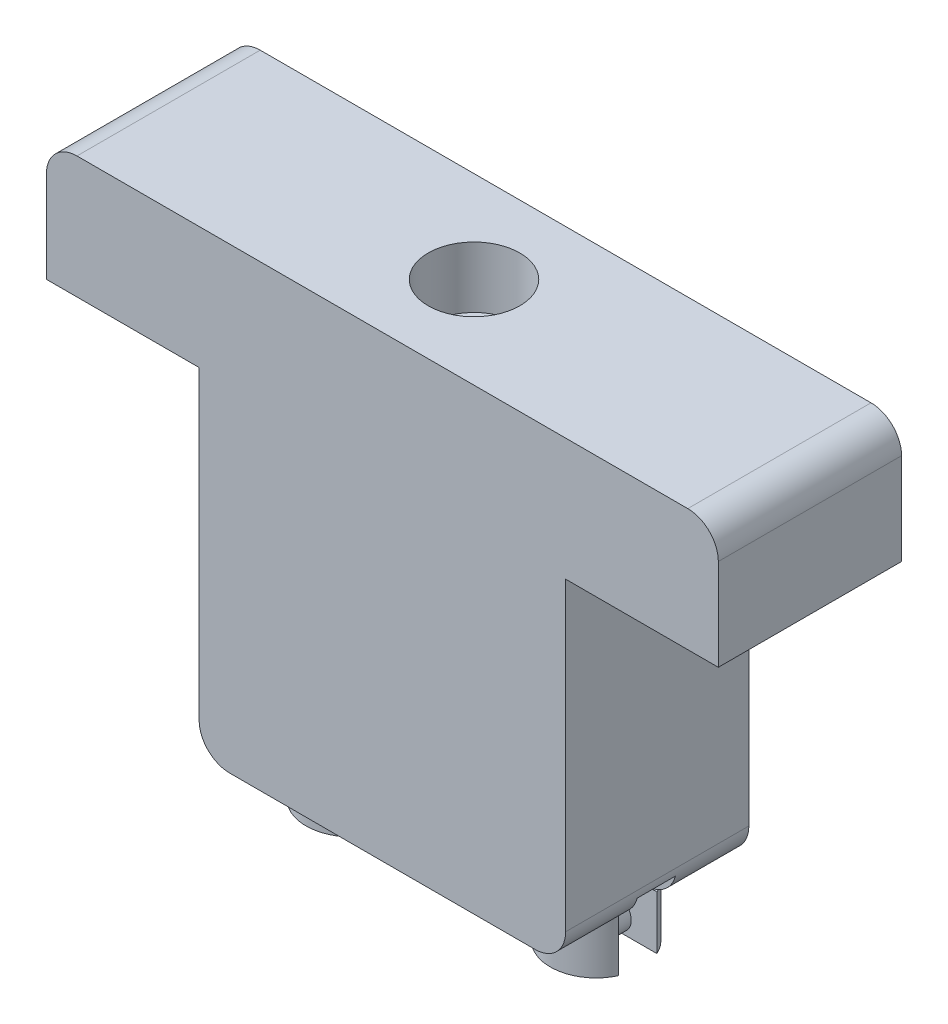
from build123d import *

# Parameters (mm, degrees)
SKETCH1_W           = 304.8
SKETCH1_H           = 381
BOSS_EXTRUDE1_DEPTH = 152.4
SKETCH2_R           = 38.1
CUT_EXTRUDE1_DEPTH  = 50.8
SKETCH5_W           = 152.4
SKETCH5_H           = 101.6
BOSS_EXTRUDE3_DEPTH = 127
SKETCH6_R           = 25.4
CUT_EXTRUDE4_DEPTH  = 50.8
FILLET4_R           = 25.4
FILLET5_R           = 25.4
SKETCH3_R           = 38.1
BOSS_EXTRUDE4_DEPTH = 44.45
SKETCH8_W           = 122.871403684
SKETCH8_H           = 31.75
CUT_EXTRUDE5_DEPTH  = 63.5
SKETCH9_R           = 12.7
BOSS_EXTRUDE5_DEPTH = 32.766


with BuildPart() as part:
    # Sketch1 → Boss-Extrude1 (new body)
    with BuildSketch(Plane.XY):
        Rectangle(SKETCH1_W, SKETCH1_H)
    extrude(amount=BOSS_EXTRUDE1_DEPTH)

    # Sketch2 → Cut-Extrude1 (cut)
    with BuildSketch(Plane(origin=(0, 190.5, 0), x_dir=(1, 0, 0), z_dir=(0, 1, 0))):
        with Locations(Location((0, -76.2, 0), (0, 0, 270))):
            Circle(SKETCH2_R)
    extrude(amount=-CUT_EXTRUDE1_DEPTH, mode=Mode.SUBTRACT)

    # Sketch5 → Boss-Extrude3 (add)
    with BuildSketch(Plane(origin=(152.4, 0, 0), x_dir=(0, 0, -1), z_dir=(1, 0, 0))):
        with Locations((-76.2, 139.7)):
            Rectangle(SKETCH5_W, SKETCH5_H)
    boss_extrude3 = extrude(amount=BOSS_EXTRUDE3_DEPTH)

    # Mirror1: Boss-Extrude3 across plane
    add(boss_extrude3.mirror(Plane(origin=(0, 0, 0), x_dir=(0, 0, 1), z_dir=(1, 0, 0))))

    # Sketch6 → Cut-Extrude4 (cut)
    with BuildSketch(Plane.XZ.offset(-88.9)):
        with Locations(Location((228.6, 76.2, 0), (0, 0, 270))):
            Circle(SKETCH6_R)
    cut_extrude4 = extrude(amount=-CUT_EXTRUDE4_DEPTH, mode=Mode.SUBTRACT)

    # Fillet4
    fillet4_edges = [part.edges().sort_by_distance(p)[0] for p in [
        (279.4, 190.5, 76.2),
        (-279.4, 190.5, 76.2),
    ]]
    fillet(fillet4_edges, radius=FILLET4_R)

    # Fillet5
    fillet5_edges = [part.edges().sort_by_distance(p)[0] for p in [
        (-152.4, -190.5, 76.2),
        (152.4, -190.5, 76.2),
    ]]
    fillet(fillet5_edges, radius=FILLET5_R)

    # Mirror2: Cut-Extrude4 across plane
    add(cut_extrude4.mirror(Plane(origin=(0, 0, 0), x_dir=(0, 0, 1), z_dir=(1, 0, 0))), mode=Mode.SUBTRACT)

    # Sketch3 → Boss-Extrude4 (add)
    with BuildSketch(Plane.XZ.offset(190.5)):
        with Locations(Location((-101.6, 76.2, 0), (0, 0, 131.810314896))):
            Circle(SKETCH3_R)
        with Locations(Location((101.6, 76.2, 0), (0, 0, 48.189685104))):
            Circle(SKETCH3_R)
    extrude(amount=BOSS_EXTRUDE4_DEPTH)

    # Sketch8 → Cut-Extrude5 (cut)
    with BuildSketch(Plane.XZ.offset(234.95)):
        with Locations((101.6, 76.2)):
            Rectangle(SKETCH8_W, SKETCH8_H)
    cut_extrude5 = extrude(amount=-CUT_EXTRUDE5_DEPTH, mode=Mode.SUBTRACT)

    # Mirror3: Cut-Extrude5 across plane
    add(cut_extrude5.mirror(Plane(origin=(0, 0, 0), x_dir=(0, 0, 1), z_dir=(1, 0, 0))), mode=Mode.SUBTRACT)

    # Sketch9 → Boss-Extrude5 (add)
    with BuildSketch(Plane.XY.offset(60.325)):
        with Locations(Location((102.203286199, -221.696968448, 0), (0, 0, 180))):
            Circle(SKETCH9_R)
    boss_extrude5 = extrude(amount=BOSS_EXTRUDE5_DEPTH)

    # Mirror4: Boss-Extrude5 across plane
    add(boss_extrude5.mirror(Plane(origin=(0, 0, 0), x_dir=(0, 0, 1), z_dir=(1, 0, 0))))


solid = part.part
